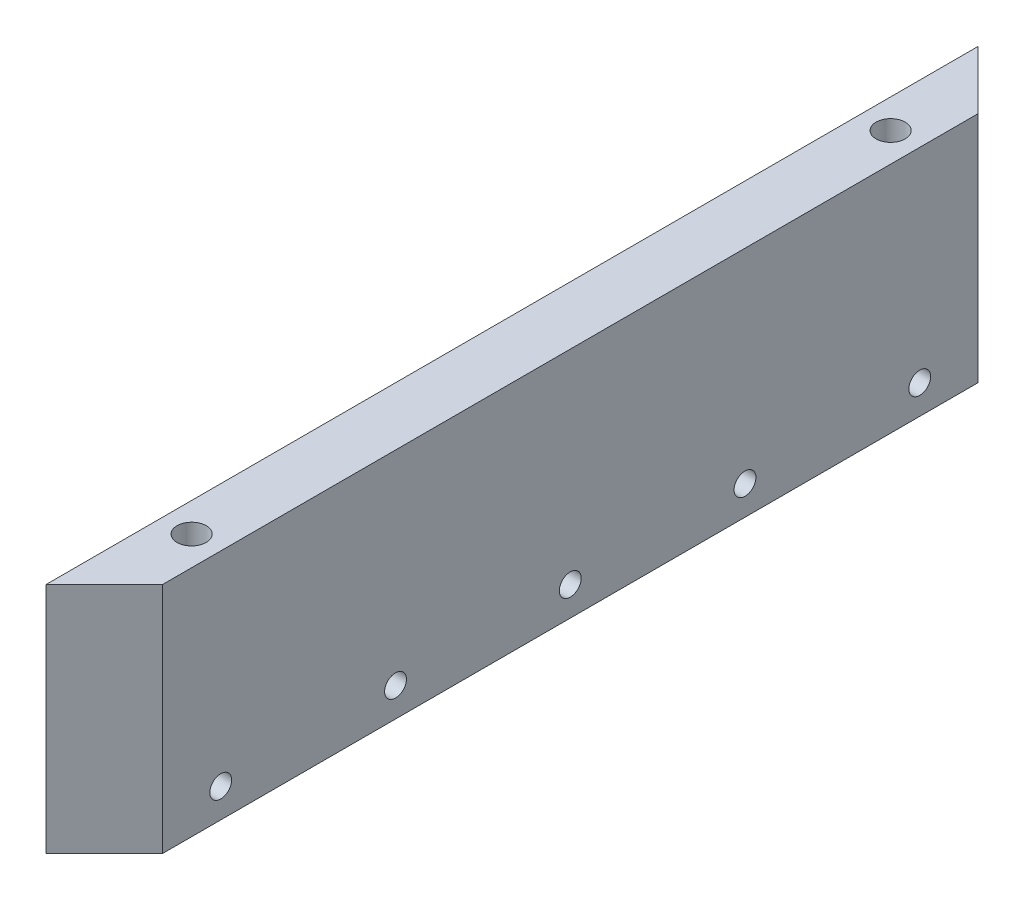
from build123d import *

# Parameters (mm, degrees)
SKETCH1_W           = 203.2
SKETCH1_H           = 50.8
BOSS_EXTRUDE1_DEPTH = 12.7
CUT_EXTRUDE1_DEPTH  = 115.3
SKETCH4_R           = 2.38125
CUT_EXTRUDE3_DEPTH  = 106.494123059
LPATTERN1_COUNT     = 5
LPATTERN1_PITCH     = 38.1
SKETCH5_R           = 3.175
CUT_EXTRUDE4_DEPTH  = 12.7


with BuildPart() as part:
    # Sketch1 → Boss-Extrude1 (new body)
    with BuildSketch(Plane(origin=(0, 0, 0), x_dir=(0, 0, -1), z_dir=(1, 0, 0))):
        Rectangle(SKETCH1_W, SKETCH1_H)
    extrude(amount=BOSS_EXTRUDE1_DEPTH)

    # Sketch2 → Cut-Extrude1 (cut, through all)
    with BuildSketch(Plane(origin=(0, 25.4, 0), x_dir=(1, 0, 0), z_dir=(0, 1, 0))):
        Polygon((0, 101.6), (12.7, 88.9), (12.7, 101.6), align=None)
        Polygon((0, -101.6), (12.7, -88.9), (12.7, -101.6), align=None)
    extrude(amount=-CUT_EXTRUDE1_DEPTH, mode=Mode.SUBTRACT)

    # Sketch4 → Cut-Extrude3 (cut, through all)
    with BuildSketch(Plane.ZY):
        with Locations((-76.2, -19.05)):
            Circle(SKETCH4_R)
    cut_extrude3 = extrude(amount=-CUT_EXTRUDE3_DEPTH, mode=Mode.SUBTRACT)

    # LPattern1: Cut-Extrude3 ×5
    with Locations(*[(0, 0, i * LPATTERN1_PITCH) for i in range(1, LPATTERN1_COUNT)]):
        add(cut_extrude3, mode=Mode.SUBTRACT)

    # Sketch5 → Cut-Extrude4 (cut)
    with BuildSketch(Plane(origin=(0, 25.4, 0), x_dir=(1, 0, 0), z_dir=(0, 1, 0))):
        with Locations(Location((6.35, 76.2, 0), (0, 0, 270))):
            Circle(SKETCH5_R)
        with Locations(Location((6.35, -76.2, 0), (0, 0, 270))):
            Circle(SKETCH5_R)
    extrude(amount=-CUT_EXTRUDE4_DEPTH, mode=Mode.SUBTRACT)


solid = part.part
